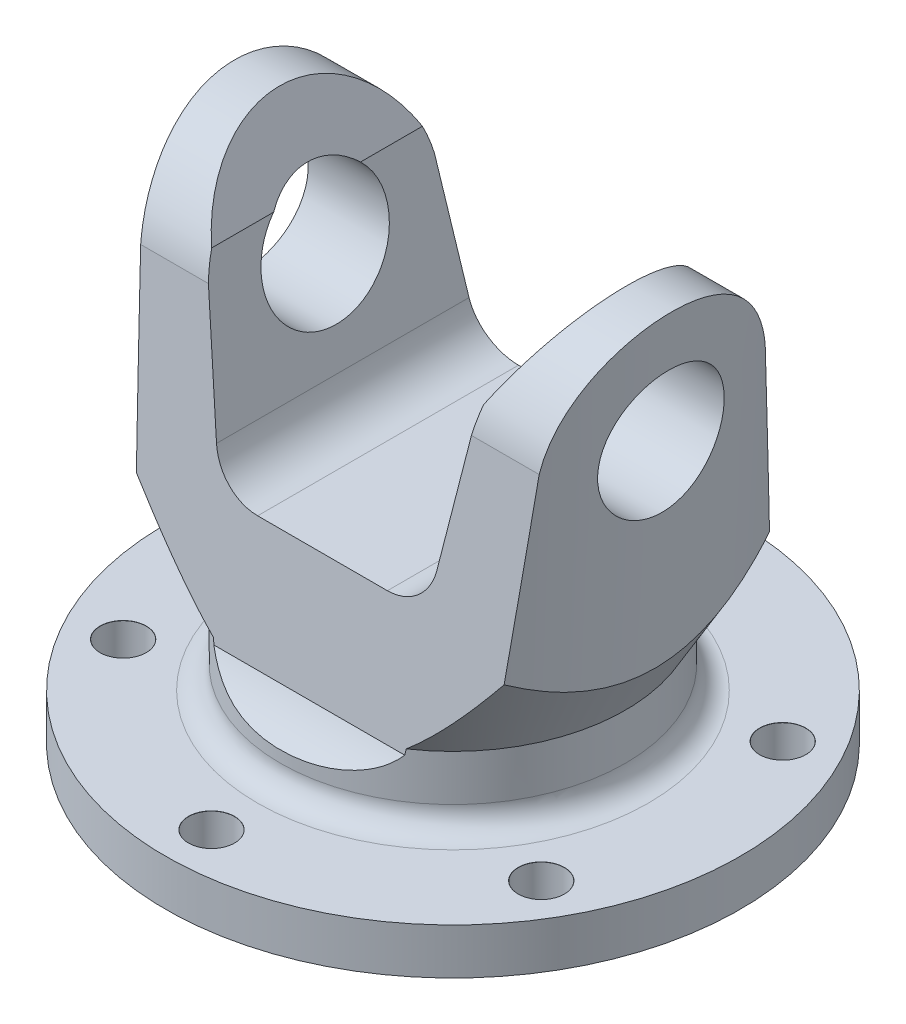
from build123d import *

# Parameters (mm, degrees)
CUT_EXTRUDE1_DEPTH                   = 159.216212497
CUT_EXTRUDE1_DEPTH_BACK              = 159.216212497
CUT_REVOLVE1_ANGLE                   = 45
CUT_EXTRUDE2_DEPTH                   = 138.24977239
CUT_EXTRUDE2_DEPTH_BACK              = 138.24977239
CUT_EXTRUDE3_DEPTH                   = 138.24977239
CUT_EXTRUDE3_DEPTH_BACK              = 138.24977239
CUT_EXTRUDE4_DEPTH                   = 138.24977239
CUT_EXTRUDE4_DEPTH_BACK              = 138.24977239
SKETCH6_R                            = 13.75
F_10_0_10_DIAMETER_HOLE1_D           = 10
F_10_0_10_DIAMETER_HOLE1_DEPTH       = 10
F_10_0_10_DIAMETER_HOLE1_CSINK_D     = 10.05
F_10_0_10_DIAMETER_HOLE1_CSINK_ANGLE = 90
CIRPATTERN1_COUNT                    = 6
FILLET3_R                            = 10
FILLET4_R                            = 5


with BuildPart() as part:
    # Sketch1 → Revolve1 (revolve)
    with BuildSketch(Plane.XY, mode=Mode.PRIVATE) as revolve1_sk:
        Polygon((0, 0), (-62.5, 0), (-62.5, 10), (-37.5, 10), (-37.5, 25), (-83.688021535, 105), (0, 105), align=None)
    revolve(revolve1_sk.sketch.rotate(Axis((0, 0, 0), (0, 1, 0)), 270), axis=Axis((0, 0, 0), (0, 1, 0)))

    # Sketch2 → Cut-Extrude1 (cut, two sides: drawn at the far end of the back side and taken through both)
    with BuildSketch(Plane(origin=(0, 0, 0), x_dir=(0, 0, -1), z_dir=(1, 0, 0)).offset(-CUT_EXTRUDE1_DEPTH_BACK)):
        with BuildLine():
            Line((-24.573687175, 84.59716202), (-31.233944355, 23.782787827))
            ThreePointArc((-31.233944355, 23.782787827), (-33.891761116, 20.167448423), (-37.5, 17.5))
            Line((-37.5, 17.5), (-101.023811283, 17.5))
            Line((-101.023811283, 17.5), (-101.023811283, 124.521875929))
            Line((-101.023811283, 124.521875929), (93.829847102, 124.521875929))
            Line((93.829847102, 124.521875929), (93.829847102, 17.5))
            Line((93.829847102, 17.5), (37.5, 17.5))
            ThreePointArc((37.5, 17.5), (33.891761116, 20.167448423), (31.233944355, 23.782787827))
            Line((31.233944355, 23.782787827), (24.573687175, 84.59716202))
            ThreePointArc((24.573687175, 84.59716202), (0, 105), (-24.573687175, 84.59716202))
        make_face()
    extrude(amount=CUT_EXTRUDE1_DEPTH + CUT_EXTRUDE1_DEPTH_BACK, mode=Mode.SUBTRACT)

    # Sketch3 → Cut-Revolve1 (revolve, symmetric, cut)
    with BuildSketch(Plane.XY) as cut_revolve1_sk:
        Polygon((47.5, 105), (43.500508947, 28.685164541), (102.973812388, 28.685164541), (102.973812388, 105), align=None)
    cut_revolve1 = revolve(axis=Axis((-52.5, 30.66973461, 0), (0, 1, 0)), revolution_arc=CUT_REVOLVE1_ANGLE / 2, mode=Mode.SUBTRACT)
    cut_revolve1 = cut_revolve1 + revolve(cut_revolve1_sk.sketch, axis=Axis((-52.5, 30.66973461, 0), (0, -1, 0)), revolution_arc=CUT_REVOLVE1_ANGLE / 2, mode=Mode.SUBTRACT)

    # Mirror1: Cut-Revolve1 across plane
    add(cut_revolve1.mirror(Plane(origin=(0, 0, 0), x_dir=(0, 0, 1), z_dir=(1, 0, 0))), mode=Mode.SUBTRACT)

    # Sketch4 → Cut-Extrude2 (cut, two sides: drawn at the far end of the back side and taken through both)
    with BuildSketch(Plane.XY.offset(-CUT_EXTRUDE2_DEPTH_BACK)):
        Polygon((-32.197983939, 105), (-22.5, 50), (22.5, 50), (32.197983939, 105), align=None)
    extrude(amount=CUT_EXTRUDE2_DEPTH + CUT_EXTRUDE2_DEPTH_BACK, mode=Mode.SUBTRACT)

    # Sketch5 → Cut-Extrude3 (cut, two sides: drawn at the far end of the back side and taken through both)
    with BuildSketch(Plane.XY.offset(-CUT_EXTRUDE3_DEPTH_BACK)):
        Polygon((37.697983939, 105), (32.197983939, 105), (29.553079228, 90), align=None)
        Polygon((-29.553079228, 90), (-37.697983939, 105), (-32.197983939, 105), align=None)
    extrude(amount=CUT_EXTRUDE3_DEPTH + CUT_EXTRUDE3_DEPTH_BACK, mode=Mode.SUBTRACT)

    # Sketch6 → Cut-Extrude4 (cut, two sides: drawn at the far end of the back side and taken through both)
    with BuildSketch(Plane(origin=(0, 0, 0), x_dir=(0, 0, -1), z_dir=(1, 0, 0)).offset(-CUT_EXTRUDE4_DEPTH_BACK)):
        with Locations(Location((0, 80, 0), (0, 0, 315.504858884))):
            Circle(SKETCH6_R)
    extrude(amount=CUT_EXTRUDE4_DEPTH + CUT_EXTRUDE4_DEPTH_BACK, mode=Mode.SUBTRACT)

    # Ø10.0 (10) Diameter Hole1
    with Locations(Plane(origin=(0, 10, 0), x_dir=(1, 0, 0), z_dir=(0, 1, 0))):
        with Locations((0, 52.5)):
            f_10_0_10_diameter_hole1 = CounterSinkHole(F_10_0_10_DIAMETER_HOLE1_D / 2, F_10_0_10_DIAMETER_HOLE1_CSINK_D / 2, depth=F_10_0_10_DIAMETER_HOLE1_DEPTH, counter_sink_angle=F_10_0_10_DIAMETER_HOLE1_CSINK_ANGLE)

    # CirPattern1: Ø10.0 (10) Diameter Hole1 ×6 about axis
    cirpattern1_axis = Axis((0, 0, 0), (0, 1, 0))
    for i in range(1, CIRPATTERN1_COUNT):
        add(f_10_0_10_diameter_hole1.rotate(cirpattern1_axis, i * 360 / CIRPATTERN1_COUNT), mode=Mode.SUBTRACT)

    # Fillet3
    fillet3_edges = [part.edges().sort_by_distance(p)[0] for p in [
        (22.5, 50, 0),
        (-22.5, 50, 0),
    ]]
    fillet(fillet3_edges, radius=FILLET3_R)

    # Fillet4
    fillet4_edges = [part.edges().sort_by_distance(p)[0] for p in [
        (0, 10, 37.5),
    ]]
    fillet(fillet4_edges, radius=FILLET4_R)


solid = part.part
